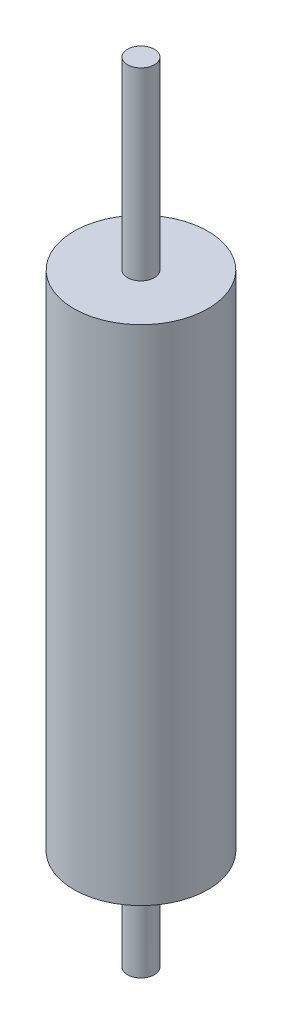
from build123d import *

# Parameters (mm, degrees)
SKETCH1_R           = 20
BOSS_EXTRUDE1_DEPTH = 150
SKETCH2_R           = 4
BOSS_EXTRUDE2_DEPTH = 30
BOSS_EXTRUDE3_START = -210
SKETCH3_R           = 4
BOSS_EXTRUDE3_DEPTH = 25


with BuildPart() as part:
    # Sketch1 → Boss-Extrude1 (new body)
    with BuildSketch(Plane(origin=(0, 0, 0), x_dir=(1, 0, 0), z_dir=(0, 1, 0))):
        with Locations(Location((0, 0, 0), (0, 0, 270))):
            Circle(SKETCH1_R)
    extrude(amount=BOSS_EXTRUDE1_DEPTH)

    # Sketch2 → Boss-Extrude2 (add)
    with BuildSketch(Plane.XZ):
        with Locations(Location((0, 0, 0), (0, 0, 90))):
            Circle(SKETCH2_R)
    boss_extrude2 = extrude(amount=BOSS_EXTRUDE2_DEPTH)

    # Mirror1: Boss-Extrude2 across plane
    add(boss_extrude2.mirror(Plane(origin=(0, 75, 0), x_dir=(0, 0, 1), z_dir=(0, -1, 0))))

    # Sketch3 → Boss-Extrude3 (add)
    with BuildSketch(Plane.XZ.offset(30).offset(BOSS_EXTRUDE3_START)):
        with Locations(Location((0, 0, 0), (0, 0, 90))):
            Circle(SKETCH3_R)
    extrude(amount=-BOSS_EXTRUDE3_DEPTH)


solid = part.part
